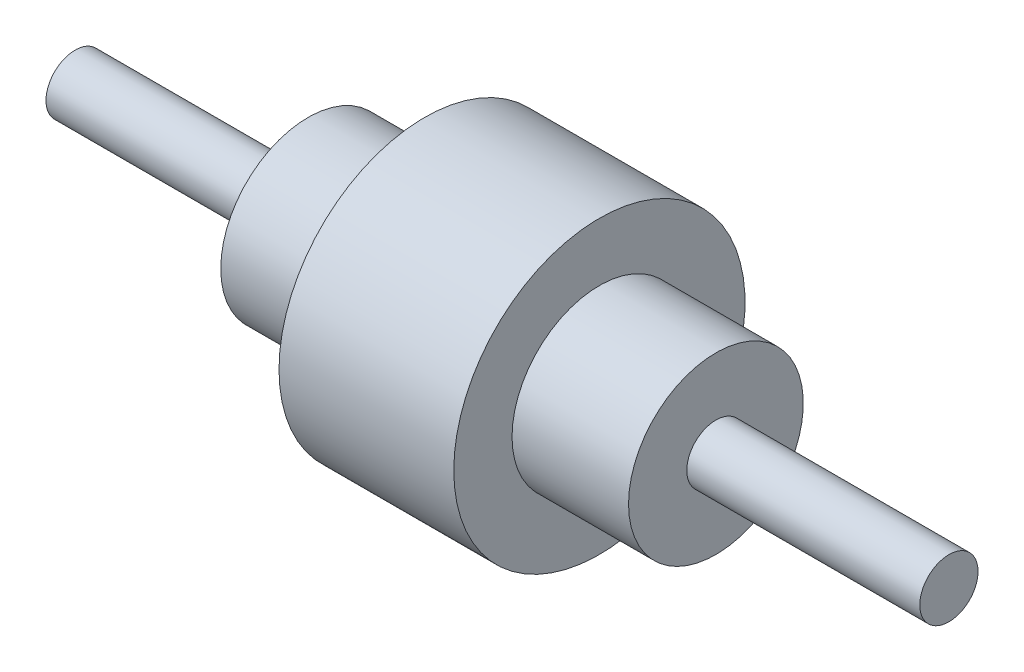
from build123d import *

# Parameters (mm, degrees)
SKETCH_1_W = 80
SKETCH_1_H = 10


with BuildPart() as part:
    # 草圖1 → 旋轉1 (revolve)
    with BuildSketch(Plane.XY, mode=Mode.PRIVATE) as revolve_1_sk:
        with Locations((40, 5)):
            Rectangle(SKETCH_1_W, SKETCH_1_H)
        Polygon((80, 30), (80, 10), (80, 0), (120, 0), (120, 30), align=None)
        Polygon((120, 50), (120, 30), (120, 0), (180, 0), (180, 30), (180, 50), align=None)
        Polygon((180, 30), (180, 0), (220, 0), (220, 10), (220, 30), align=None)
        with Locations((260, 5)):
            Rectangle(SKETCH_1_W, SKETCH_1_H)
    revolve(revolve_1_sk.sketch.rotate(Axis((0, 0, 0), (1, 0, 0)), 90), axis=Axis((0, 0, 0), (1, 0, 0)))


solid = part.part
